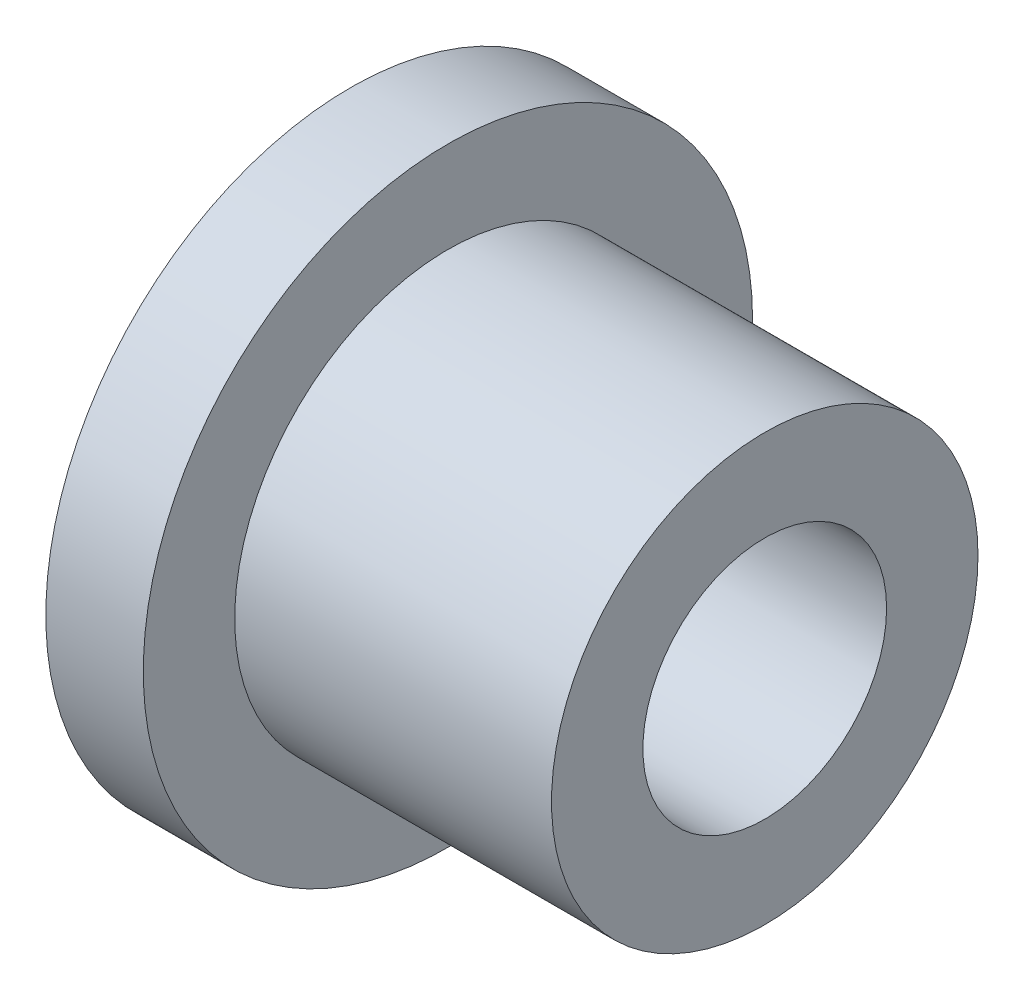
from build123d import *


with BuildPart() as part:
    # Sketch1 → Revolve3 (revolve)
    with BuildSketch(Plane.XY, mode=Mode.PRIVATE) as revolve3_sk:
        Polygon((-24.3, 25), (-24.3, 10), (9.7, 10), (9.7, 17.5), (-16.3, 17.5), (-16.3, 25), align=None)
    revolve(revolve3_sk.sketch.rotate(Axis((0, 0, 0), (-1, 0, 0)), 90), axis=Axis((0, 0, 0), (-1, 0, 0)))


solid = part.part
